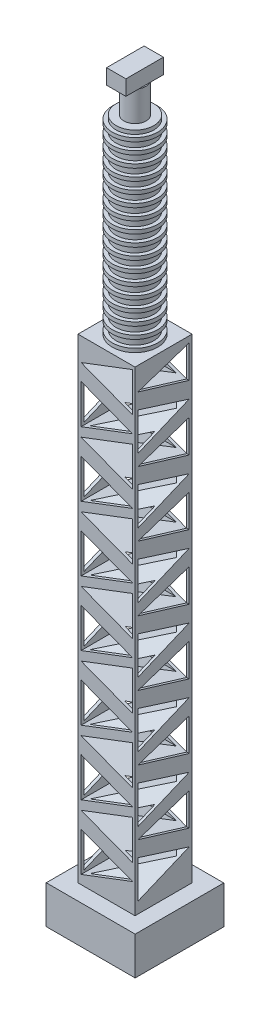
from build123d import *

# Parameters (mm, degrees)
CROQUIS1_W              = 300
CROQUIS1_H              = 300
SALIENTE_EXTRUIR1_DEPTH = 2500
CROQUIS2_W              = 468.00430217
CROQUIS2_H              = 466.117188048
SALIENTE_EXTRUIR2_DEPTH = 200
CORTAR_EXTRUIR1_DEPTH   = 2540.978522186
MATRIZL1_COUNT          = 7
MATRIZL1_PITCH          = 340
CORTAR_EXTRUIR2_DEPTH   = 2541.03424392
MATRIZL2_COUNT          = 7
MATRIZL2_PITCH          = 340
CROQUIS5_R              = 99.510683161
SALIENTE_EXTRUIR3_DEPTH = 1000
CROQUIS6_R              = 119.342946135
SALIENTE_EXTRUIR4_DEPTH = 20
MATRIZL4_COUNT          = 17
MATRIZL4_PITCH          = 60
CROQUIS7_R              = 57.952406804
SALIENTE_EXTRUIR5_DEPTH = 158
CROQUIS8_W              = 101.712593078
CROQUIS8_H              = 197.500180732
SALIENTE_EXTRUIR6_DEPTH = 80


with BuildPart() as part:
    # Croquis1 → Saliente-Extruir1 (new body)
    with BuildSketch(Plane(origin=(0, 0, 0), x_dir=(1, 0, 0), z_dir=(0, 1, 0))):
        Rectangle(CROQUIS1_W, CROQUIS1_H)
    extrude(amount=SALIENTE_EXTRUIR1_DEPTH)

    # Croquis2 → Saliente-Extruir2 (add)
    with BuildSketch(Plane.XZ):
        Rectangle(CROQUIS2_W, CROQUIS2_H)
    extrude(amount=SALIENTE_EXTRUIR2_DEPTH)

    # Croquis3 → Cortar-Extruir1 (cut, through all)
    with BuildSketch(Plane(origin=(0, 0, -150), x_dir=(-1, 0, 0), z_dir=(0, 0, -1))):
        Polygon((-136.870238973, 2481.863206005), (-136.870238973, 2275.780617225), (133.700778948, 2378.821911615), align=None)
        Polygon((133.700778948, 2275.780617225), (133.700778948, 2086.521096917), (-136.870238973, 2189.562391307), (133.700778948, 2292.603685697), align=None)
    cortar_extruir1 = extrude(amount=-CORTAR_EXTRUIR1_DEPTH, mode=Mode.SUBTRACT)

    # MatrizL1: Cortar-Extruir1 ×7
    with Locations(*[(0, -i * MATRIZL1_PITCH, 0) for i in range(1, MATRIZL1_COUNT)]):
        add(cortar_extruir1, mode=Mode.SUBTRACT)

    # Croquis4 → Cortar-Extruir2 (cut, through all)
    with BuildSketch(Plane.ZY.offset(150)):
        Polygon((134.682014996, 2296.792813434), (134.682014996, 2098.538414464), (-135, 2211.511014866), align=None)
        Polygon((-135, 2468.270955352), (-135, 2296.792813434), (134.682014996, 2378.821911615), align=None)
    cortar_extruir2 = extrude(amount=-CORTAR_EXTRUIR2_DEPTH, mode=Mode.SUBTRACT)

    # MatrizL2: Cortar-Extruir2 ×7
    with Locations(*[(0, -i * MATRIZL2_PITCH, 0) for i in range(1, MATRIZL2_COUNT)]):
        add(cortar_extruir2, mode=Mode.SUBTRACT)

    # Croquis5 → Saliente-Extruir3 (add)
    with BuildSketch(Plane(origin=(0, 2500, 0), x_dir=(1, 0, 0), z_dir=(0, 1, 0))):
        with Locations(Location((0, 0, 0), (0, 0, 270))):
            Circle(CROQUIS5_R)
    extrude(amount=SALIENTE_EXTRUIR3_DEPTH)

    # Croquis6 → Saliente-Extruir4 (add)
    with BuildSketch(Plane(origin=(0, 2500, 0), x_dir=(1, 0, 0), z_dir=(0, 1, 0))):
        with Locations(Location((0, 0, 0), (0, 0, 270))):
            Circle(CROQUIS6_R)
    saliente_extruir4 = extrude(amount=SALIENTE_EXTRUIR4_DEPTH)

    # MatrizL4: Saliente-Extruir4 ×17
    with Locations(*[(0, i * MATRIZL4_PITCH, 0) for i in range(1, MATRIZL4_COUNT)]):
        add(saliente_extruir4)

    # Croquis7 → Saliente-Extruir5 (add)
    with BuildSketch(Plane(origin=(0, 3500, 0), x_dir=(1, 0, 0), z_dir=(0, 1, 0))):
        with Locations(Location((0, 0, 0), (0, 0, 90))):
            Circle(CROQUIS7_R)
    extrude(amount=SALIENTE_EXTRUIR5_DEPTH)

    # Croquis8 → Saliente-Extruir6 (add)
    with BuildSketch(Plane(origin=(0, 3658, 0), x_dir=(1, 0, 0), z_dir=(0, 1, 0))):
        Rectangle(CROQUIS8_W, CROQUIS8_H)
    extrude(amount=SALIENTE_EXTRUIR6_DEPTH)


solid = part.part
